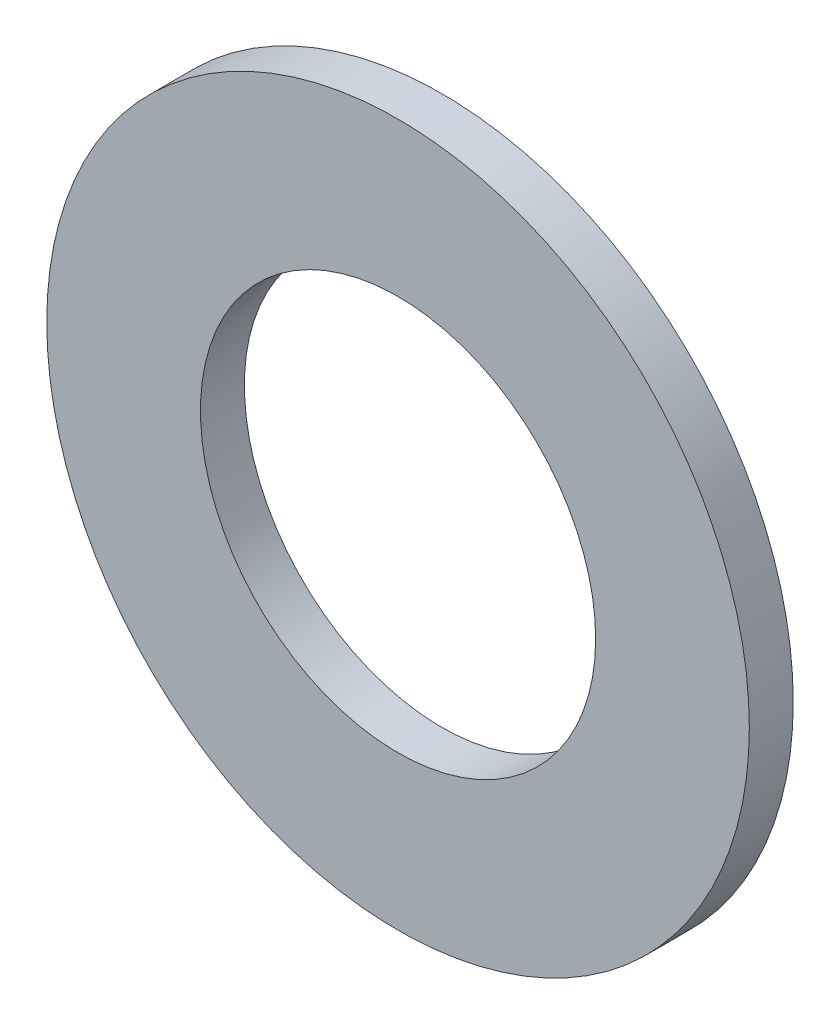
from build123d import *

# Parameters (mm, degrees)
SKETCH_1_R      = 8
SKETCH_1_R_2    = 4.5
EXTRUDE_1_DEPTH = 1


with BuildPart() as part:
    # Эскиз1 → Бобышка-Вытянуть1 (new body)
    with BuildSketch(Plane.XY):
        Circle(SKETCH_1_R)
        Circle(SKETCH_1_R_2, mode=Mode.SUBTRACT)
    extrude(amount=EXTRUDE_1_DEPTH)


solid = part.part
